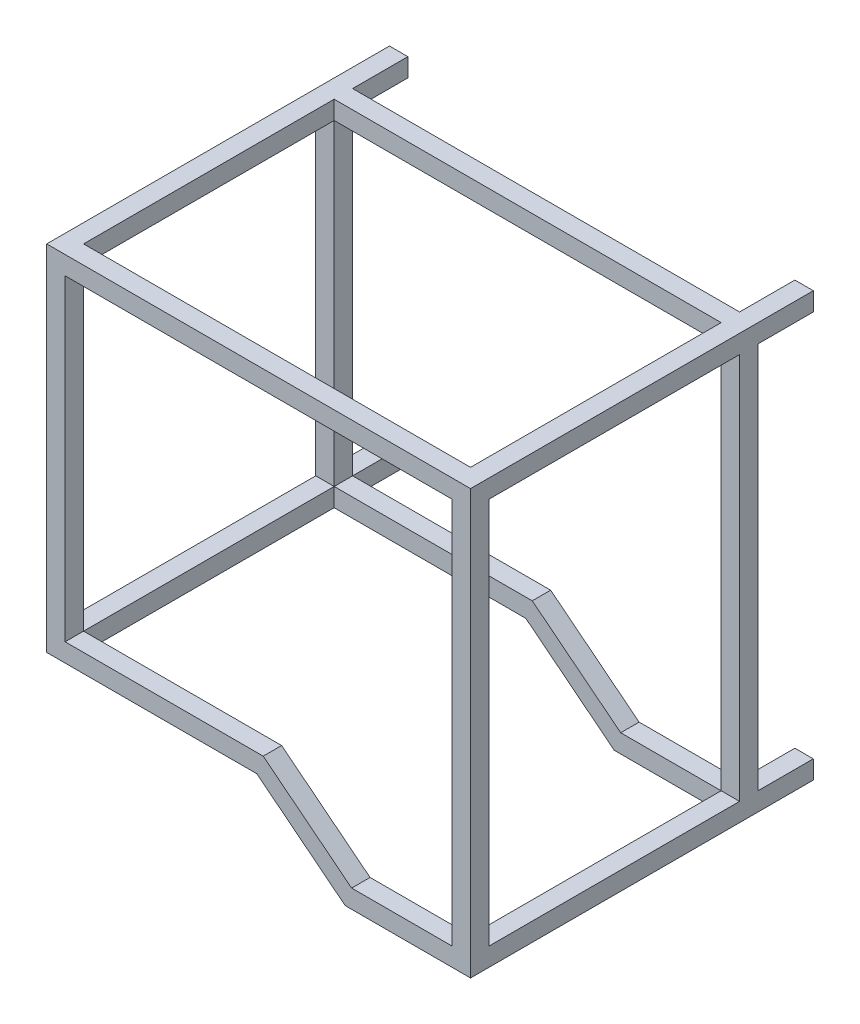
from build123d import *

# Parameters (mm, degrees)
ESTRUSIONE_ESTRUSIONE1_DEPTH = 50
ESTRUSIONE_ESTRUSIONE4_DEPTH = 50
SCHIZZO5_W                   = 50
SCHIZZO5_H                   = 50
ESTRUSIONE_ESTRUSIONE5_DEPTH = 680
SCHIZZO6_W                   = 50
SCHIZZO6_H                   = 50
ESTRUSIONE_ESTRUSIONE6_DEPTH = 150


with BuildPart() as part:
    # Schizzo1 → Estrusione-Estrusione1 (new body)
    with BuildSketch(Plane.XY):
        Polygon((0, 0), (1150, 0), (1150, -1150), (810, -1150), (570, -960), (0, -960), align=None)
        Polygon((50, -50), (1100, -50), (1100, -1100), (827.395936132, -1100), (587.395936132, -910), (50, -910), align=None, mode=Mode.SUBTRACT)
    extrude(amount=ESTRUSIONE_ESTRUSIONE1_DEPTH)



with BuildPart() as body_2:
    # Schizzo4 → Estrusione-Estrusione4 (new body)
    with BuildSketch(Plane(origin=(0, 0, 780), x_dir=(-1, 0, 0), z_dir=(0, 0, -1))):
        Polygon((-1150, -1150), (-810, -1150), (-570, -960), (0, -960), (0, 0), (-1150, 0), align=None)
        Polygon((-50, -50), (-1100, -50), (-1100, -1100), (-827.395936132, -1100), (-587.395936132, -910), (-50, -910), align=None, mode=Mode.SUBTRACT)
    extrude(amount=ESTRUSIONE_ESTRUSIONE4_DEPTH)


with BuildPart() as part_1:
    add(part.part)

    add(body_2.part)  # Estrusione-Estrusione5 merges body 2
    # Schizzo5 → Estrusione-Estrusione5 (add)
    with BuildSketch(Plane(origin=(0, 0, 730), x_dir=(-1, 0, 0), z_dir=(0, 0, -1))):
        with Locations((-1125, -25)):
            Rectangle(SCHIZZO5_W, SCHIZZO5_H)
        with Locations((-25, -25)):
            Rectangle(SCHIZZO5_W, SCHIZZO5_H)
        with Locations((-25, -935)):
            Rectangle(SCHIZZO5_W, SCHIZZO5_H)
        with Locations((-1125, -1125)):
            Rectangle(SCHIZZO5_W, SCHIZZO5_H)
    extrude(amount=ESTRUSIONE_ESTRUSIONE5_DEPTH)

    # Schizzo6 → Estrusione-Estrusione6 (add)
    with BuildSketch(Plane(origin=(0, 0, 0), x_dir=(-1, 0, 0), z_dir=(0, 0, -1))):
        with Locations((-25, -935)):
            Rectangle(SCHIZZO6_W, SCHIZZO6_H)
        with Locations((-1125, -1125)):
            Rectangle(SCHIZZO6_W, SCHIZZO6_H)
        with Locations((-1125, -25)):
            Rectangle(SCHIZZO6_W, SCHIZZO6_H)
        with Locations((-25, -25)):
            Rectangle(SCHIZZO6_W, SCHIZZO6_H)
    extrude(amount=ESTRUSIONE_ESTRUSIONE6_DEPTH)


solid = part_1.part
